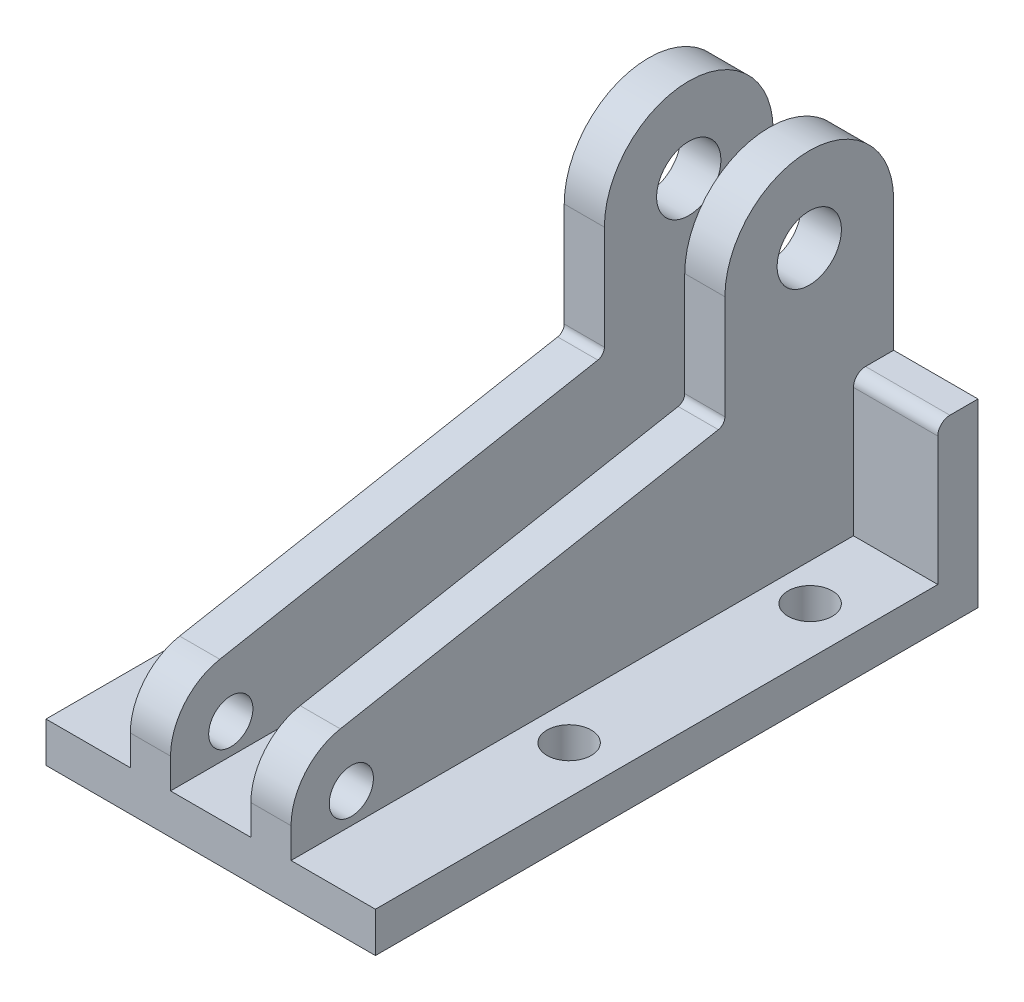
from build123d import *

# Parameters (mm, degrees)
BOSS_EXTRUDE1_DEPTH = 82
SKETCH2_R           = 8
SKETCH2_R_2         = 5.5
BOSS_EXTRUDE2_DEPTH = 10
SKETCH3_R           = 5.5
CUT_EXTRUDE1_DEPTH  = 148.200134968


with BuildPart() as part:
    # Sketch1 → Boss-Extrude1 (new body)
    with BuildSketch(Plane(origin=(0, 0, 0), x_dir=(0, 0, -1), z_dir=(1, 0, 0))):
        with BuildLine():
            Line((-84.297520661, 0), (65.702479339, 0))
            Line((65.702479339, 0), (65.702479339, 45))
            Line((65.702479339, 45), (58.702479339, 45))
            ThreePointArc((58.702479339, 45), (56.581158995, 44.121320344), (55.702479339, 42))
            Line((55.702479339, 42), (55.702479339, 10))
            Line((55.702479339, 10), (-84.297520661, 10))
            Line((-84.297520661, 10), (-84.297520661, 0))
        make_face()
    extrude(amount=-BOSS_EXTRUDE1_DEPTH)

    # Sketch2 → Boss-Extrude2 (add)
    with BuildSketch(Plane(origin=(-21, 0, 0), x_dir=(0, 0, -1), z_dir=(1, 0, 0))):
        with BuildLine():
            Line((65.702479339, 45), (65.702479339, 77.531394121))
            ThreePointArc((65.702479339, 77.531394121), (44.702479339, 98.531394121), (23.702479339, 77.531394121))
            Line((23.702479339, 77.531394121), (23.702479339, 51.663245522))
            ThreePointArc((23.702479339, 51.663245522), (23.240214757, 50.384429748), (22.067109554, 49.696765213))
            Line((22.067109554, 49.696765213), (-72.032247278, 32.248602318))
            ThreePointArc((-72.032247278, 32.248602318), (-80.830536296, 27.091118307), (-84.297520661, 17.5))
            Line((-84.297520661, 17.5), (-84.297520661, 10))
            Line((-84.297520661, 10), (55.702479339, 10))
            Line((55.702479339, 10), (55.702479339, 42))
            ThreePointArc((55.702479339, 42), (56.581158995, 44.121320344), (58.702479339, 45))
            Line((58.702479339, 45), (65.702479339, 45))
        make_face()
        with Locations((44.702479339, 77.531394121)):
            Circle(SKETCH2_R, mode=Mode.SUBTRACT)
        with Locations((-69.297520661, 17.5)):
            Circle(SKETCH2_R_2, mode=Mode.SUBTRACT)
    extrude(amount=-BOSS_EXTRUDE2_DEPTH)

    # Mirror1: part across plane


with BuildPart() as part_1:
    add(part.part)
    add(part.part.mirror(Plane(origin=(-41, 0, 0), x_dir=(0, 0, 1), z_dir=(1, 0, 0))))

    # Sketch3 → Cut-Extrude1 (cut, through all)
    with BuildSketch(Plane(origin=(0, 10, 0), x_dir=(1, 0, 0), z_dir=(0, 1, 0))):
        with Locations(Location((-11.776828818, -24.297520661, 0), (0, 0, 270))):
            Circle(SKETCH3_R)
        with Locations(Location((-11.776828818, 35.702479339, 0), (0, 0, 270))):
            Circle(SKETCH3_R)
    extrude(amount=-CUT_EXTRUDE1_DEPTH, mode=Mode.SUBTRACT)


solid = part_1.part
